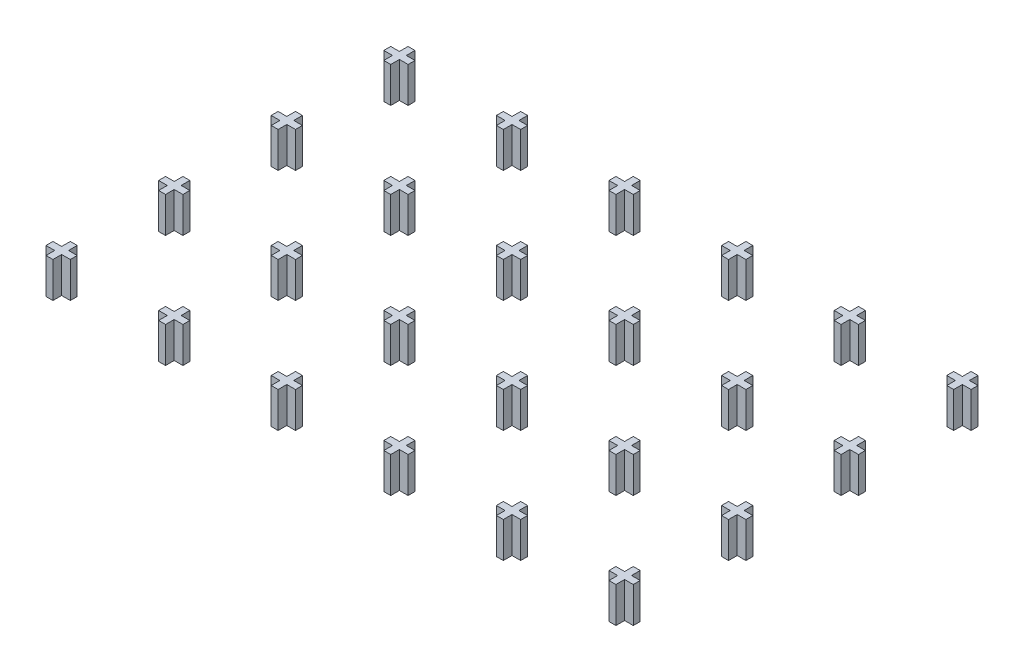
from build123d import *

# Parameters (mm, degrees)
BOSS_EXTRUDE1_DEPTH    = 6
BOSS_EXTRUDE1_2_DEPTH  = 6
BOSS_EXTRUDE1_3_DEPTH  = 6
BOSS_EXTRUDE1_4_DEPTH  = 6
BOSS_EXTRUDE1_5_DEPTH  = 6
BOSS_EXTRUDE1_6_DEPTH  = 6
BOSS_EXTRUDE1_7_DEPTH  = 6
BOSS_EXTRUDE1_8_DEPTH  = 6
BOSS_EXTRUDE1_9_DEPTH  = 6
BOSS_EXTRUDE1_10_DEPTH = 6
BOSS_EXTRUDE1_11_DEPTH = 6
BOSS_EXTRUDE1_12_DEPTH = 6
BOSS_EXTRUDE1_13_DEPTH = 6
BOSS_EXTRUDE1_14_DEPTH = 6
BOSS_EXTRUDE1_15_DEPTH = 6
BOSS_EXTRUDE1_16_DEPTH = 6
BOSS_EXTRUDE1_17_DEPTH = 6
BOSS_EXTRUDE1_18_DEPTH = 6
BOSS_EXTRUDE1_19_DEPTH = 6
BOSS_EXTRUDE1_20_DEPTH = 6
BOSS_EXTRUDE1_21_DEPTH = 6
BOSS_EXTRUDE1_22_DEPTH = 6
BOSS_EXTRUDE1_23_DEPTH = 6
BOSS_EXTRUDE1_24_DEPTH = 6


with BuildPart() as part:
    # Sketch1 → Boss-Extrude1 (new body)
    with BuildSketch(Plane(origin=(0, 0, 0), x_dir=(1, 0, 0), z_dir=(0, 1, 0))):
        Polygon((-61.87264188, 22.127287386), (-60.70264188, 22.127287386), (-60.70264188, 20.662287386), (-59.23764188, 20.662287386), (-59.23764188, 19.492287386), (-60.70264188, 19.492287386), (-60.70264188, 18.027287386), (-61.87264188, 18.027287386), (-61.87264188, 19.492287386), (-63.33764188, 19.492287386), (-63.33764188, 20.662287386), (-61.87264188, 20.662287386), align=None)
    extrude(amount=BOSS_EXTRUDE1_DEPTH)


with BuildPart() as body_2:
    # Sketch1 → Boss-Extrude1 2 (new body)
    with BuildSketch(Plane(origin=(0, 0, 0), x_dir=(1, 0, 0), z_dir=(0, 1, 0))):
        Polygon((-61.87264188, 3.127287386), (-60.70264188, 3.127287386), (-60.70264188, 1.662287386), (-59.23764188, 1.662287386), (-59.23764188, 0.492287386), (-60.70264188, 0.492287386), (-60.70264188, -0.972712614), (-61.87264188, -0.972712614), (-61.87264188, 0.492287386), (-63.33764188, 0.492287386), (-63.33764188, 1.662287386), (-61.87264188, 1.662287386), align=None)
    extrude(amount=BOSS_EXTRUDE1_2_DEPTH)


with BuildPart() as body_3:
    # Sketch1 → Boss-Extrude1 3 (new body)
    with BuildSketch(Plane(origin=(0, 0, 0), x_dir=(1, 0, 0), z_dir=(0, 1, 0))):
        Polygon((-61.87264188, -15.872712614), (-60.70264188, -15.872712614), (-60.70264188, -17.337712614), (-59.23764188, -17.337712614), (-59.23764188, -18.507712614), (-60.70264188, -18.507712614), (-60.70264188, -19.972712614), (-61.87264188, -19.972712614), (-61.87264188, -18.507712614), (-63.33764188, -18.507712614), (-63.33764188, -17.337712614), (-61.87264188, -17.337712614), align=None)
    extrude(amount=BOSS_EXTRUDE1_3_DEPTH)


with BuildPart() as body_4:
    # Sketch1 → Boss-Extrude1 4 (new body)
    with BuildSketch(Plane(origin=(0, 0, 0), x_dir=(1, 0, 0), z_dir=(0, 1, 0))):
        Polygon((-42.87264188, -15.872712614), (-41.70264188, -15.872712614), (-41.70264188, -17.337712614), (-40.23764188, -17.337712614), (-40.23764188, -18.507712614), (-41.70264188, -18.507712614), (-41.70264188, -19.972712614), (-42.87264188, -19.972712614), (-42.87264188, -18.507712614), (-44.33764188, -18.507712614), (-44.33764188, -17.337712614), (-42.87264188, -17.337712614), align=None)
    extrude(amount=BOSS_EXTRUDE1_4_DEPTH)


with BuildPart() as body_5:
    # Sketch1 → Boss-Extrude1 5 (new body)
    with BuildSketch(Plane(origin=(0, 0, 0), x_dir=(1, 0, 0), z_dir=(0, 1, 0))):
        Polygon((-42.87264188, 3.127287386), (-41.70264188, 3.127287386), (-41.70264188, 1.662287386), (-40.23764188, 1.662287386), (-40.23764188, 0.492287386), (-41.70264188, 0.492287386), (-41.70264188, -0.972712614), (-42.87264188, -0.972712614), (-42.87264188, 0.492287386), (-44.33764188, 0.492287386), (-44.33764188, 1.662287386), (-42.87264188, 1.662287386), align=None)
    extrude(amount=BOSS_EXTRUDE1_5_DEPTH)


with BuildPart() as body_6:
    # Sketch1 → Boss-Extrude1 6 (new body)
    with BuildSketch(Plane(origin=(0, 0, 0), x_dir=(1, 0, 0), z_dir=(0, 1, 0))):
        Polygon((-42.87264188, 22.127287386), (-41.70264188, 22.127287386), (-41.70264188, 20.662287386), (-40.23764188, 20.662287386), (-40.23764188, 19.492287386), (-41.70264188, 19.492287386), (-41.70264188, 18.027287386), (-42.87264188, 18.027287386), (-42.87264188, 19.492287386), (-44.33764188, 19.492287386), (-44.33764188, 20.662287386), (-42.87264188, 20.662287386), align=None)
    extrude(amount=BOSS_EXTRUDE1_6_DEPTH)


with BuildPart() as body_7:
    # Sketch1 → Boss-Extrude1 7 (new body)
    with BuildSketch(Plane(origin=(0, 0, 0), x_dir=(1, 0, 0), z_dir=(0, 1, 0))):
        Polygon((-23.87264188, 22.127287386), (-22.70264188, 22.127287386), (-22.70264188, 20.662287386), (-21.23764188, 20.662287386), (-21.23764188, 19.492287386), (-22.70264188, 19.492287386), (-22.70264188, 18.027287386), (-23.87264188, 18.027287386), (-23.87264188, 19.492287386), (-25.33764188, 19.492287386), (-25.33764188, 20.662287386), (-23.87264188, 20.662287386), align=None)
    extrude(amount=BOSS_EXTRUDE1_7_DEPTH)


with BuildPart() as body_8:
    # Sketch1 → Boss-Extrude1 8 (new body)
    with BuildSketch(Plane(origin=(0, 0, 0), x_dir=(1, 0, 0), z_dir=(0, 1, 0))):
        Polygon((-23.87264188, 3.127287386), (-22.70264188, 3.127287386), (-22.70264188, 1.662287386), (-21.23764188, 1.662287386), (-21.23764188, 0.492287386), (-22.70264188, 0.492287386), (-22.70264188, -0.972712614), (-23.87264188, -0.972712614), (-23.87264188, 0.492287386), (-25.33764188, 0.492287386), (-25.33764188, 1.662287386), (-23.87264188, 1.662287386), align=None)
    extrude(amount=BOSS_EXTRUDE1_8_DEPTH)


with BuildPart() as body_9:
    # Sketch1 → Boss-Extrude1 9 (new body)
    with BuildSketch(Plane(origin=(0, 0, 0), x_dir=(1, 0, 0), z_dir=(0, 1, 0))):
        Polygon((-23.87264188, -15.872712614), (-22.70264188, -15.872712614), (-22.70264188, -17.337712614), (-21.23764188, -17.337712614), (-21.23764188, -18.507712614), (-22.70264188, -18.507712614), (-22.70264188, -19.972712614), (-23.87264188, -19.972712614), (-23.87264188, -18.507712614), (-25.33764188, -18.507712614), (-25.33764188, -17.337712614), (-23.87264188, -17.337712614), align=None)
    extrude(amount=BOSS_EXTRUDE1_9_DEPTH)


with BuildPart() as body_10:
    # Sketch1 → Boss-Extrude1 10 (new body)
    with BuildSketch(Plane(origin=(0, 0, 0), x_dir=(1, 0, 0), z_dir=(0, 1, 0))):
        Polygon((-4.87264188, -15.872712614), (-3.70264188, -15.872712614), (-3.70264188, -17.337712614), (-2.23764188, -17.337712614), (-2.23764188, -18.507712614), (-3.70264188, -18.507712614), (-3.70264188, -19.972712614), (-4.87264188, -19.972712614), (-4.87264188, -18.507712614), (-6.33764188, -18.507712614), (-6.33764188, -17.337712614), (-4.87264188, -17.337712614), align=None)
    extrude(amount=BOSS_EXTRUDE1_10_DEPTH)


with BuildPart() as body_11:
    # Sketch1 → Boss-Extrude1 11 (new body)
    with BuildSketch(Plane(origin=(0, 0, 0), x_dir=(1, 0, 0), z_dir=(0, 1, 0))):
        Polygon((-4.87264188, 3.127287386), (-3.70264188, 3.127287386), (-3.70264188, 1.662287386), (-2.23764188, 1.662287386), (-2.23764188, 0.492287386), (-3.70264188, 0.492287386), (-3.70264188, -0.972712614), (-4.87264188, -0.972712614), (-4.87264188, 0.492287386), (-6.33764188, 0.492287386), (-6.33764188, 1.662287386), (-4.87264188, 1.662287386), align=None)
    extrude(amount=BOSS_EXTRUDE1_11_DEPTH)


with BuildPart() as body_12:
    # Sketch1 → Boss-Extrude1 12 (new body)
    with BuildSketch(Plane(origin=(0, 0, 0), x_dir=(1, 0, 0), z_dir=(0, 1, 0))):
        Polygon((-4.87264188, 22.127287386), (-3.70264188, 22.127287386), (-3.70264188, 20.662287386), (-2.23764188, 20.662287386), (-2.23764188, 19.492287386), (-3.70264188, 19.492287386), (-3.70264188, 18.027287386), (-4.87264188, 18.027287386), (-4.87264188, 19.492287386), (-6.33764188, 19.492287386), (-6.33764188, 20.662287386), (-4.87264188, 20.662287386), align=None)
    extrude(amount=BOSS_EXTRUDE1_12_DEPTH)


with BuildPart() as body_13:
    # Sketch1 → Boss-Extrude1 13 (new body)
    with BuildSketch(Plane(origin=(0, 0, 0), x_dir=(1, 0, 0), z_dir=(0, 1, 0))):
        Polygon((14.12735812, 22.127287386), (15.29735812, 22.127287386), (15.29735812, 20.662287386), (16.76235812, 20.662287386), (16.76235812, 19.492287386), (15.29735812, 19.492287386), (15.29735812, 18.027287386), (14.12735812, 18.027287386), (14.12735812, 19.492287386), (12.66235812, 19.492287386), (12.66235812, 20.662287386), (14.12735812, 20.662287386), align=None)
    extrude(amount=BOSS_EXTRUDE1_13_DEPTH)


with BuildPart() as body_14:
    # Sketch1 → Boss-Extrude1 14 (new body)
    with BuildSketch(Plane(origin=(0, 0, 0), x_dir=(1, 0, 0), z_dir=(0, 1, 0))):
        Polygon((14.12735812, 3.127287386), (15.29735812, 3.127287386), (15.29735812, 1.662287386), (16.76235812, 1.662287386), (16.76235812, 0.492287386), (15.29735812, 0.492287386), (15.29735812, -0.972712614), (14.12735812, -0.972712614), (14.12735812, 0.492287386), (12.66235812, 0.492287386), (12.66235812, 1.662287386), (14.12735812, 1.662287386), align=None)
    extrude(amount=BOSS_EXTRUDE1_14_DEPTH)


with BuildPart() as body_15:
    # Sketch1 → Boss-Extrude1 15 (new body)
    with BuildSketch(Plane(origin=(0, 0, 0), x_dir=(1, 0, 0), z_dir=(0, 1, 0))):
        Polygon((14.12735812, -15.872712614), (15.29735812, -15.872712614), (15.29735812, -17.337712614), (16.76235812, -17.337712614), (16.76235812, -18.507712614), (15.29735812, -18.507712614), (15.29735812, -19.972712614), (14.12735812, -19.972712614), (14.12735812, -18.507712614), (12.66235812, -18.507712614), (12.66235812, -17.337712614), (14.12735812, -17.337712614), align=None)
    extrude(amount=BOSS_EXTRUDE1_15_DEPTH)


with BuildPart() as body_16:
    # Sketch1 → Boss-Extrude1 16 (new body)
    with BuildSketch(Plane(origin=(0, 0, 0), x_dir=(1, 0, 0), z_dir=(0, 1, 0))):
        Polygon((33.12735812, -15.872712614), (34.29735812, -15.872712614), (34.29735812, -17.337712614), (35.76235812, -17.337712614), (35.76235812, -18.507712614), (34.29735812, -18.507712614), (34.29735812, -19.972712614), (33.12735812, -19.972712614), (33.12735812, -18.507712614), (31.66235812, -18.507712614), (31.66235812, -17.337712614), (33.12735812, -17.337712614), align=None)
    extrude(amount=BOSS_EXTRUDE1_16_DEPTH)


with BuildPart() as body_17:
    # Sketch1 → Boss-Extrude1 17 (new body)
    with BuildSketch(Plane(origin=(0, 0, 0), x_dir=(1, 0, 0), z_dir=(0, 1, 0))):
        Polygon((33.12735812, 3.127287386), (34.29735812, 3.127287386), (34.29735812, 1.662287386), (35.76235812, 1.662287386), (35.76235812, 0.492287386), (34.29735812, 0.492287386), (34.29735812, -0.972712614), (33.12735812, -0.972712614), (33.12735812, 0.492287386), (31.66235812, 0.492287386), (31.66235812, 1.662287386), (33.12735812, 1.662287386), align=None)
    extrude(amount=BOSS_EXTRUDE1_17_DEPTH)


with BuildPart() as body_18:
    # Sketch1 → Boss-Extrude1 18 (new body)
    with BuildSketch(Plane(origin=(0, 0, 0), x_dir=(1, 0, 0), z_dir=(0, 1, 0))):
        Polygon((33.12735812, 22.127287386), (34.29735812, 22.127287386), (34.29735812, 20.662287386), (35.76235812, 20.662287386), (35.76235812, 19.492287386), (34.29735812, 19.492287386), (34.29735812, 18.027287386), (33.12735812, 18.027287386), (33.12735812, 19.492287386), (31.66235812, 19.492287386), (31.66235812, 20.662287386), (33.12735812, 20.662287386), align=None)
    extrude(amount=BOSS_EXTRUDE1_18_DEPTH)


with BuildPart() as body_19:
    # Sketch1 → Boss-Extrude1 19 (new body)
    with BuildSketch(Plane(origin=(0, 0, 0), x_dir=(1, 0, 0), z_dir=(0, 1, 0))):
        Polygon((33.12735812, -34.872712614), (34.29735812, -34.872712614), (34.29735812, -36.337712614), (35.76235812, -36.337712614), (35.76235812, -37.507712614), (34.29735812, -37.507712614), (34.29735812, -38.972712614), (33.12735812, -38.972712614), (33.12735812, -37.507712614), (31.66235812, -37.507712614), (31.66235812, -36.337712614), (33.12735812, -36.337712614), align=None)
    extrude(amount=BOSS_EXTRUDE1_19_DEPTH)


with BuildPart() as body_20:
    # Sketch1 → Boss-Extrude1 20 (new body)
    with BuildSketch(Plane(origin=(0, 0, 0), x_dir=(1, 0, 0), z_dir=(0, 1, 0))):
        Polygon((-61.87264188, -34.872712614), (-60.70264188, -34.872712614), (-60.70264188, -36.337712614), (-59.23764188, -36.337712614), (-59.23764188, -37.507712614), (-60.70264188, -37.507712614), (-60.70264188, -38.972712614), (-61.87264188, -38.972712614), (-61.87264188, -37.507712614), (-63.33764188, -37.507712614), (-63.33764188, -36.337712614), (-61.87264188, -36.337712614), align=None)
    extrude(amount=BOSS_EXTRUDE1_20_DEPTH)


with BuildPart() as body_21:
    # Sketch1 → Boss-Extrude1 21 (new body)
    with BuildSketch(Plane(origin=(0, 0, 0), x_dir=(1, 0, 0), z_dir=(0, 1, 0))):
        Polygon((-42.87264188, -34.872712614), (-41.70264188, -34.872712614), (-41.70264188, -36.337712614), (-40.23764188, -36.337712614), (-40.23764188, -37.507712614), (-41.70264188, -37.507712614), (-41.70264188, -38.972712614), (-42.87264188, -38.972712614), (-42.87264188, -37.507712614), (-44.33764188, -37.507712614), (-44.33764188, -36.337712614), (-42.87264188, -36.337712614), align=None)
    extrude(amount=BOSS_EXTRUDE1_21_DEPTH)


with BuildPart() as body_22:
    # Sketch1 → Boss-Extrude1 22 (new body)
    with BuildSketch(Plane(origin=(0, 0, 0), x_dir=(1, 0, 0), z_dir=(0, 1, 0))):
        Polygon((-23.87264188, -34.872712614), (-22.70264188, -34.872712614), (-22.70264188, -36.337712614), (-21.23764188, -36.337712614), (-21.23764188, -37.507712614), (-22.70264188, -37.507712614), (-22.70264188, -38.972712614), (-23.87264188, -38.972712614), (-23.87264188, -37.507712614), (-25.33764188, -37.507712614), (-25.33764188, -36.337712614), (-23.87264188, -36.337712614), align=None)
    extrude(amount=BOSS_EXTRUDE1_22_DEPTH)


with BuildPart() as body_23:
    # Sketch1 → Boss-Extrude1 23 (new body)
    with BuildSketch(Plane(origin=(0, 0, 0), x_dir=(1, 0, 0), z_dir=(0, 1, 0))):
        Polygon((-4.87264188, -34.872712614), (-3.70264188, -34.872712614), (-3.70264188, -36.337712614), (-2.23764188, -36.337712614), (-2.23764188, -37.507712614), (-3.70264188, -37.507712614), (-3.70264188, -38.972712614), (-4.87264188, -38.972712614), (-4.87264188, -37.507712614), (-6.33764188, -37.507712614), (-6.33764188, -36.337712614), (-4.87264188, -36.337712614), align=None)
    extrude(amount=BOSS_EXTRUDE1_23_DEPTH)


with BuildPart() as body_24:
    # Sketch1 → Boss-Extrude1 24 (new body)
    with BuildSketch(Plane(origin=(0, 0, 0), x_dir=(1, 0, 0), z_dir=(0, 1, 0))):
        Polygon((14.12735812, -34.872712614), (15.29735812, -34.872712614), (15.29735812, -36.337712614), (16.76235812, -36.337712614), (16.76235812, -37.507712614), (15.29735812, -37.507712614), (15.29735812, -38.972712614), (14.12735812, -38.972712614), (14.12735812, -37.507712614), (12.66235812, -37.507712614), (12.66235812, -36.337712614), (14.12735812, -36.337712614), align=None)
    extrude(amount=BOSS_EXTRUDE1_24_DEPTH)


solid = Compound([part.part, body_2.part, body_3.part, body_4.part, body_5.part, body_6.part, body_7.part, body_8.part, body_9.part, body_10.part, body_11.part, body_12.part, body_13.part, body_14.part, body_15.part, body_16.part, body_17.part, body_18.part, body_19.part, body_20.part, body_21.part, body_22.part, body_23.part, body_24.part])
